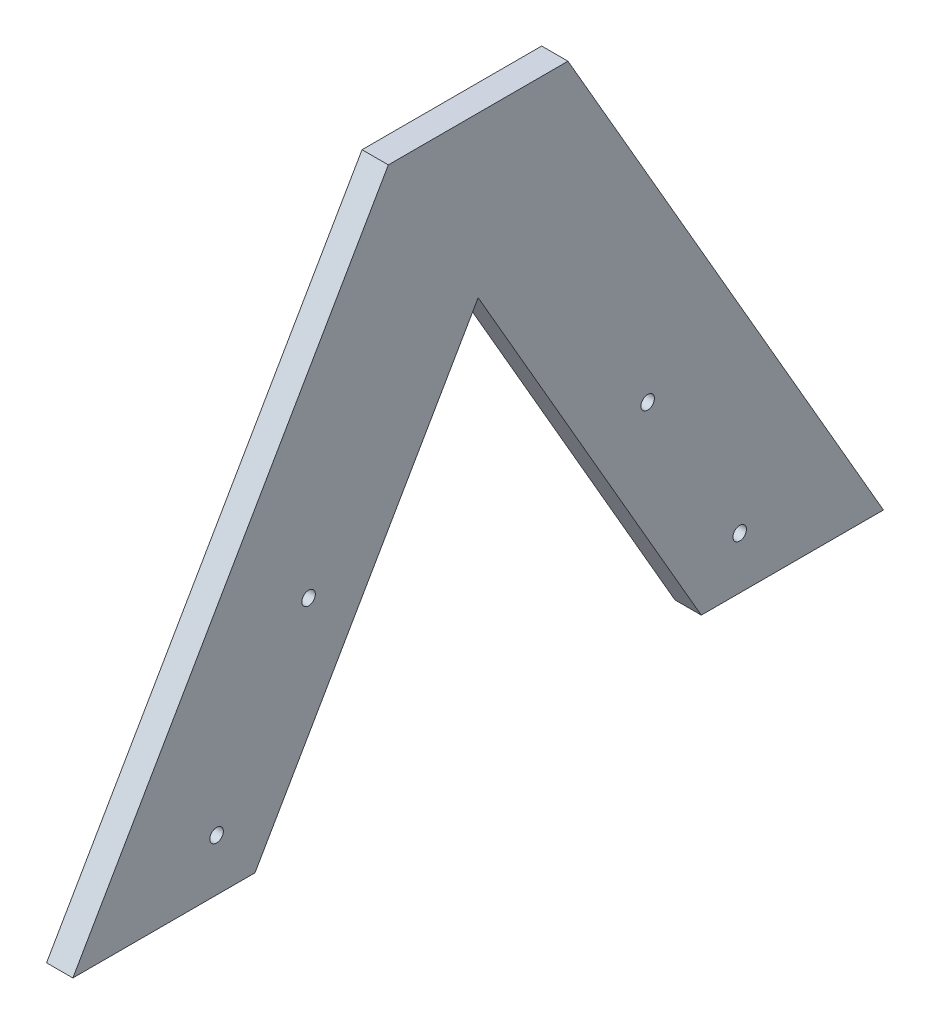
from build123d import *

# Parameters (mm, degrees)
BOSS_EXTRUDE1_DEPTH                            = 6.35
CSK_FOR_4_FLAT_HEAD_MACHINE_SCREW1_D           = 3.2639
CSK_FOR_4_FLAT_HEAD_MACHINE_SCREW1_CSINK_D     = 5.715
CSK_FOR_4_FLAT_HEAD_MACHINE_SCREW1_CSINK_ANGLE = 82


with BuildPart() as part:
    # Sketch1 → Boss-Extrude1 (new body)
    with BuildSketch(Plane(origin=(0, 0, 0), x_dir=(0, 0, -1), z_dir=(1, 0, 0))):
        Polygon((0, 0), (76.2, 131.982271537), (119.58608314, 131.982271537), (195.78608314, 0), (151.791992628, 0), (97.89304157, 93.355721707), (43.994090512, 0), align=None)
    extrude(amount=BOSS_EXTRUDE1_DEPTH)

    # CSK for #4 Flat Head Machine Screw1 (through all)
    with Locations(Plane.ZY):
        with Locations((-161.066379527, 12.511290682), (-138.841379527, 51.00611988), (-56.944703613, 51.00611988), (-34.719703613, 12.511290682)):
            CounterSinkHole(CSK_FOR_4_FLAT_HEAD_MACHINE_SCREW1_D / 2, CSK_FOR_4_FLAT_HEAD_MACHINE_SCREW1_CSINK_D / 2, counter_sink_angle=CSK_FOR_4_FLAT_HEAD_MACHINE_SCREW1_CSINK_ANGLE)


solid = part.part
